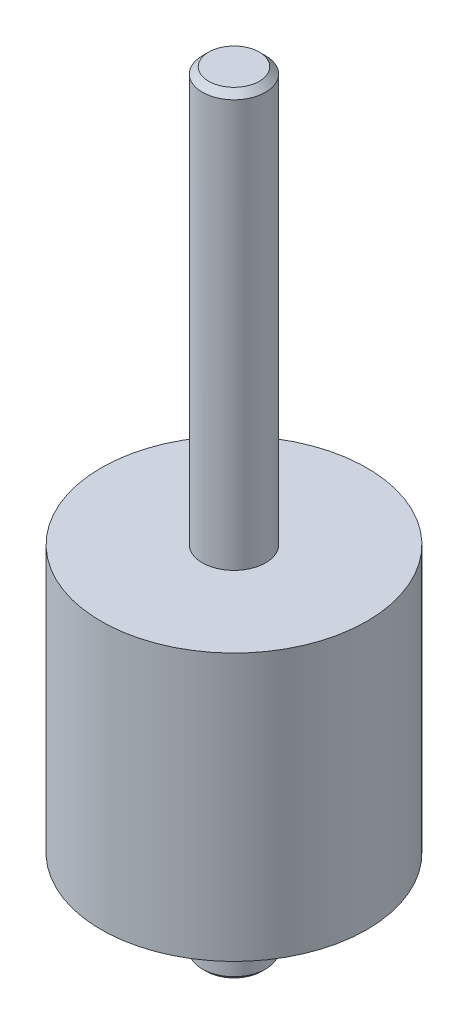
from build123d import *

# Parameters (mm, degrees)
CHAMFER1_SIZE = 0.3
CHAMFER2_SIZE = 0.5


with BuildPart() as part:
    # Sketch1 → Revolve1 (revolve)
    with BuildSketch(Plane.XY, mode=Mode.PRIVATE) as revolve1_sk:
        Polygon((0, -38.6), (2.5, -38.6), (2.5, -31.6), (10.5, -31.6), (10.5, -10.5), (2.5, -10.5), (2.5, 22.2), (0, 22.2), align=None)
    revolve(revolve1_sk.sketch.rotate(Axis((0, 22.2, 0), (0, -1, 0)), 180), axis=Axis((0, 22.2, 0), (0, -1, 0)))

    # Chamfer1
    chamfer1_edges = [part.edges().sort_by_distance(p)[0] for p in [
        (2.5, -38.6, 0),
    ]]
    chamfer(chamfer1_edges, length=CHAMFER1_SIZE)

    # Chamfer2
    chamfer2_edges = [part.edges().sort_by_distance(p)[0] for p in [
        (2.5, 22.2, 0),
    ]]
    chamfer(chamfer2_edges, length=CHAMFER2_SIZE)


solid = part.part
